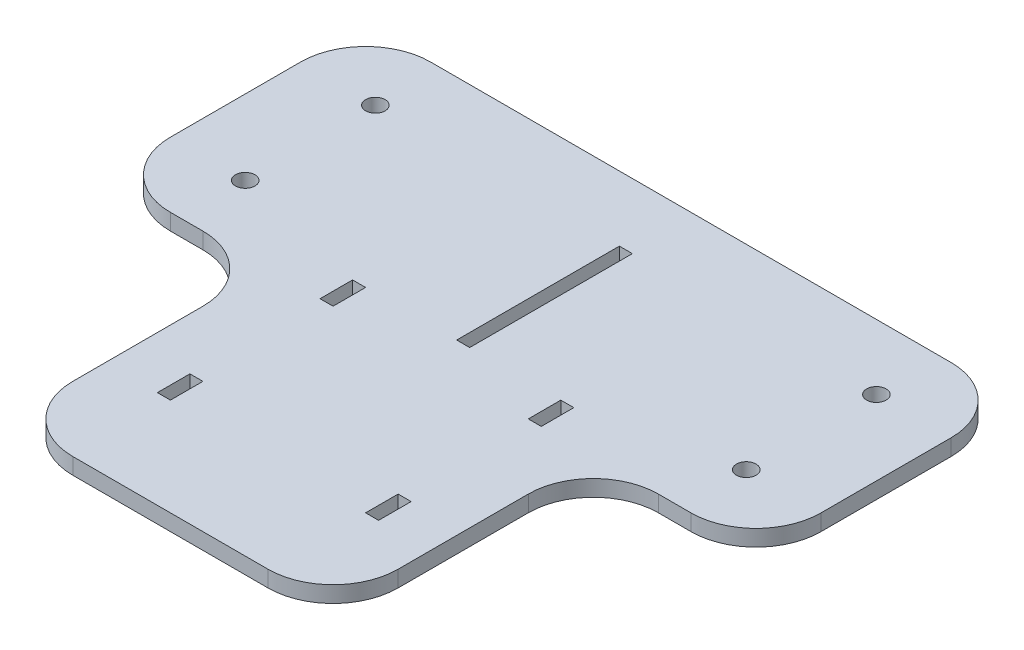
from build123d import *

# Parameters (mm, degrees)
SKETCH1_R           = 1.5
SKETCH1_W           = 2
SKETCH1_H           = 5
SKETCH1_H_2         = 25
BOSS_EXTRUDE1_DEPTH = 1.25
FILLET1_R           = 10


with BuildPart() as part:
    # Sketch1 → Boss-Extrude1 (new, symmetric)
    with BuildSketch(Plane(origin=(0, 0, 0), x_dir=(1, 0, 0), z_dir=(0, 1, 0))):
        Polygon((-50, 40), (50, 40), (50, 0), (25, 0), (25, -40), (-25, -40), (-25, 0), (-50, 0), align=None)
        with Locations(Location((-38.5, 30, 0), (0, 0, 270))):
            Circle(SKETCH1_R, mode=Mode.SUBTRACT)
        with Locations(Location((38.5, 30, 0), (0, 0, 90))):
            Circle(SKETCH1_R, mode=Mode.SUBTRACT)
        with Locations(Location((-38.5, 10, 0), (0, 0, 270))):
            Circle(SKETCH1_R, mode=Mode.SUBTRACT)
        with Locations(Location((38.5, 10, 0), (0, 0, 90))):
            Circle(SKETCH1_R, mode=Mode.SUBTRACT)
        with Locations((16, -22.5)):
            Rectangle(SKETCH1_W, SKETCH1_H, mode=Mode.SUBTRACT)
        with Locations((-16, -22.5)):
            Rectangle(SKETCH1_W, SKETCH1_H, mode=Mode.SUBTRACT)
        with Locations((-16, 2.5)):
            Rectangle(SKETCH1_W, SKETCH1_H, mode=Mode.SUBTRACT)
        with Locations((16, 2.5)):
            Rectangle(SKETCH1_W, SKETCH1_H, mode=Mode.SUBTRACT)
        with Locations((0, 17.5)):
            Rectangle(SKETCH1_W, SKETCH1_H_2, mode=Mode.SUBTRACT)
    extrude(amount=BOSS_EXTRUDE1_DEPTH, both=True)

    # Fillet1
    fillet1_edges = [part.edges().sort_by_distance(p)[0] for p in [
        (50, 0, 0),
        (25, 0, 0),
        (25, 0, 40),
        (-25, 0, 40),
        (-25, 0, 0),
        (-50, 0, 0),
        (-50, 0, -40),
        (50, 0, -40),
    ]]
    fillet(fillet1_edges, radius=FILLET1_R)


solid = part.part
